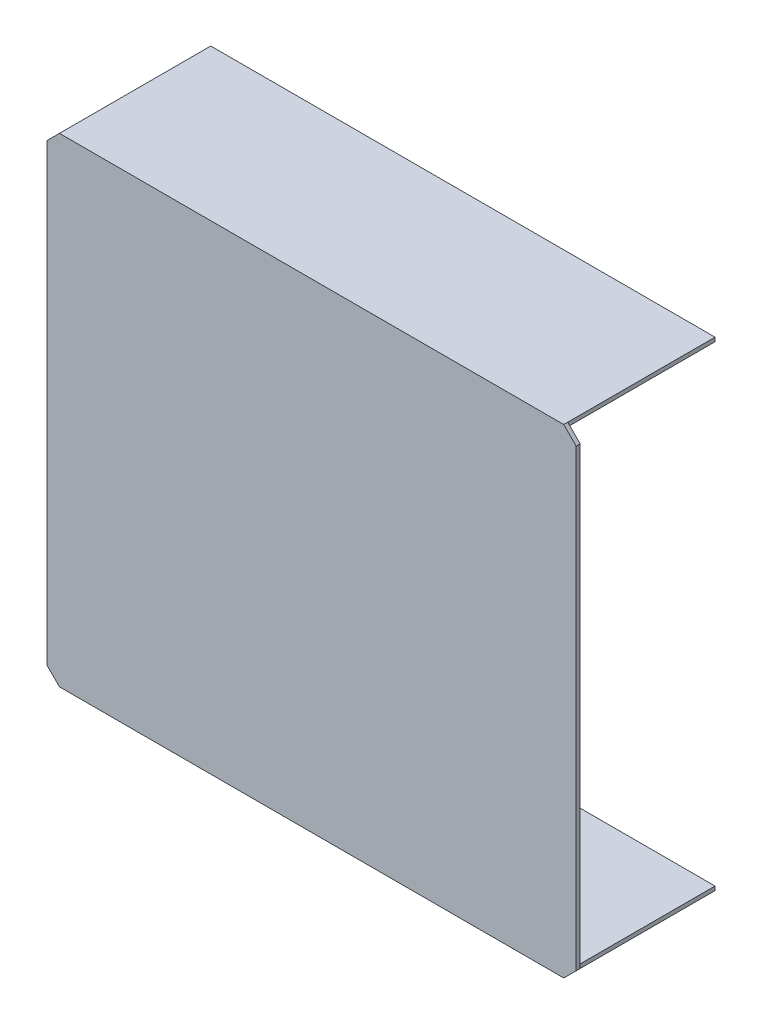
from build123d import *

# Parameters (mm, degrees)
F_5052_START                            = 86
F_5052_SHEET_TOP_PANEL_DEPTH            = 1.6
FOLDED_START                            = 27
SKETCH2_W                               = 202
SKETCH2_H                               = 1.6
FOLDED_SIDE_SKIRTS_WITH_OPEN_ENDS_DEPTH = 59


with BuildPart() as part:
    # Sketch1 → 5052 sheet top panel (new body)
    with BuildSketch(Plane.XY.offset(F_5052_START)):
        Polygon((-101, -96), (101, -96), (106, -91), (106, 91), (101, 96), (-101, 96), (-106, 91), (-106, -91), align=None)
    extrude(amount=F_5052_SHEET_TOP_PANEL_DEPTH)

    # Sketch2 → Folded side skirts with open ends (add)
    with BuildSketch(Plane.XY.offset(FOLDED_START)):
        with Locations((0, 95.2)):
            Rectangle(SKETCH2_W, SKETCH2_H)
        with Locations((0, -95.2)):
            Rectangle(SKETCH2_W, SKETCH2_H)
    extrude(amount=FOLDED_SIDE_SKIRTS_WITH_OPEN_ENDS_DEPTH)


solid = part.part
